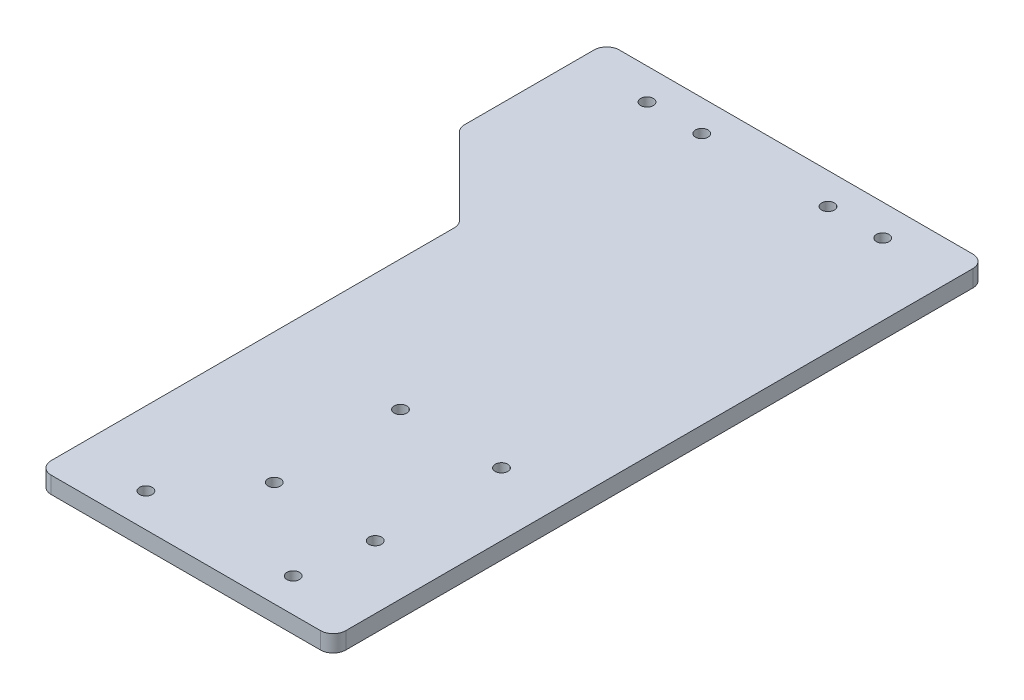
from build123d import *

# Parameters (mm, degrees)
EXTRUDE_1_DEPTH     = 4
SKETCH_2_R          = 1.5
CUT_EXTRUDE_1_DEPTH = 4
SKETCH_3_R          = 1.5
CUT_EXTRUDE_2_DEPTH = 4
EXTRUDE_2_DEPTH     = 4
FILLET_2_R          = 3
SKETCH_6_R          = 1.5
CUT_EXTRUDE_3_DEPTH = 167.255826966


with BuildPart() as part:
    # 草图1 → 凸台-拉伸1 (new body)
    with BuildSketch(Plane(origin=(0, 0, 0), x_dir=(1, 0, 0), z_dir=(0, 1, 0))):
        Polygon((0, 0), (60, 0), (60, 155), (-30, 155), (-30, 120), (0, 90), align=None)
    extrude(amount=EXTRUDE_1_DEPTH)

    # 草图2 → 切除-拉伸1 (cut)
    with BuildSketch(Plane(origin=(0, 4, 0), x_dir=(1, 0, 0), z_dir=(0, 1, 0))):
        with Locations(Location((45, 25, 0), (0, 0, 270))):
            Circle(SKETCH_2_R)
        with Locations(Location((21, 25, 0), (0, 0, 270))):
            Circle(SKETCH_2_R)
        with Locations(Location((45, 55, 0), (0, 0, 270))):
            Circle(SKETCH_2_R)
        with Locations(Location((21, 55, 0), (0, 0, 270))):
            Circle(SKETCH_2_R)
    extrude(amount=-CUT_EXTRUDE_1_DEPTH, mode=Mode.SUBTRACT)

    # 草图3 → 切除-拉伸2 (cut)
    with BuildSketch(Plane(origin=(0, 4, 0), x_dir=(1, 0, 0), z_dir=(0, 1, 0))):
        with Locations(Location((30, 147.590674679, 0), (0, 0, 270))):
            Circle(SKETCH_3_R)
        with Locations(Location((43, 147.590674679, 0), (0, 0, 270))):
            Circle(SKETCH_3_R)
        with Locations(Location((-13, 147.590674679, 0), (0, 0, 90))):
            Circle(SKETCH_3_R)
        with Locations(Location((0, 147.590674679, 0), (0, 0, 90))):
            Circle(SKETCH_3_R)
    extrude(amount=-CUT_EXTRUDE_2_DEPTH, mode=Mode.SUBTRACT)

    # 草图5 → 凸台-拉伸2 (add)
    with BuildSketch(Plane(origin=(0, 4, 0), x_dir=(1, 0, 0), z_dir=(0, 1, 0))):
        Polygon((0, 0), (-10, 0), (-10, 100), (0, 90), align=None)
    extrude(amount=-EXTRUDE_2_DEPTH)

    # 圆角2
    fillet_2_edges = [part.edges().sort_by_distance(p)[0] for p in [
        (-30, 2, -120),
        (-30, 2, -155),
        (60, 2, -155),
        (60, 2, 0),
        (-10, 2, 0),
        (-10, 2, -100),
    ]]
    fillet(fillet_2_edges, radius=FILLET_2_R)

    # 草图6 → 切除-拉伸3 (cut, through all)
    with BuildSketch(Plane(origin=(0, 4, 0), x_dir=(1, 0, 0), z_dir=(0, 1, 0))):
        with Locations(Location((7.5, 8, 0), (0, 0, 270))):
            Circle(SKETCH_6_R)
        with Locations(Location((42.5, 8, 0), (0, 0, 270))):
            Circle(SKETCH_6_R)
    extrude(amount=-CUT_EXTRUDE_3_DEPTH, mode=Mode.SUBTRACT)


solid = part.part
